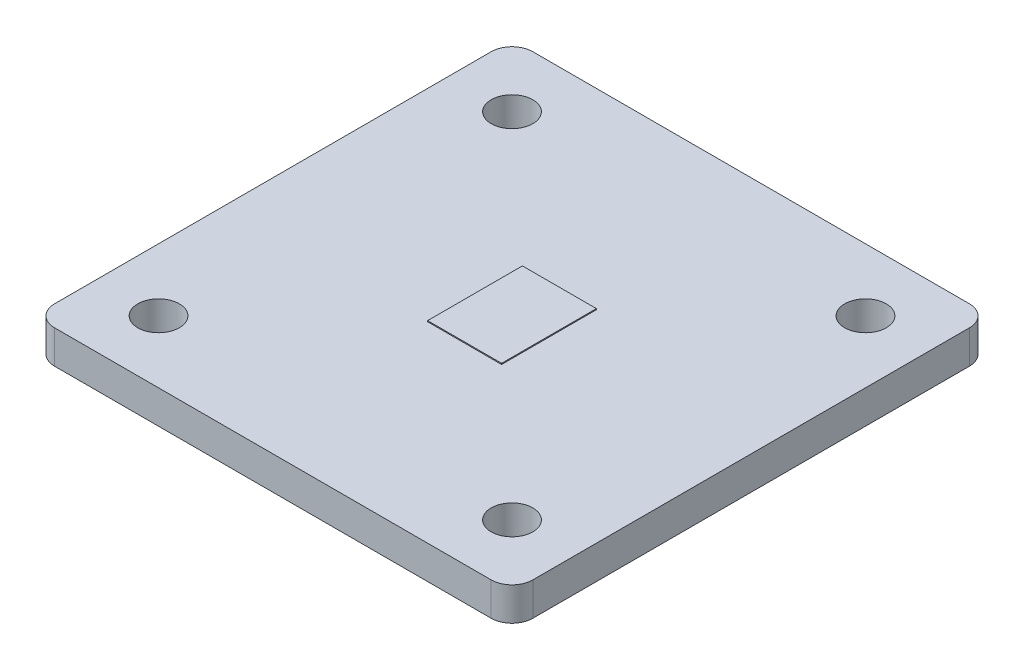
from build123d import *

# Parameters (mm, degrees)
BOSS_EXTRUDE1_DEPTH = 1.6
SKETCH2_R           = 1
CUT_EXTRUDE1_DEPTH  = 1.6
SKETCH4_W           = 3.557
SKETCH4_H           = 4.557
BOSS_EXTRUDE2_DEPTH = 0.05


with BuildPart() as part:
    # Sketch1 → Boss-Extrude1 (new body)
    with BuildSketch(Plane(origin=(0, 0, 0), x_dir=(1, 0, 0), z_dir=(0, 1, 0))):
        with BuildLine():
            Line((-10.5, -11.5), (10.5, -11.5))
            ThreePointArc((10.5, -11.5), (11.207106781, -11.207106781), (11.5, -10.5))
            Line((11.5, -10.5), (11.5, 10.5))
            ThreePointArc((11.5, 10.5), (11.207106781, 11.207106781), (10.5, 11.5))
            Line((10.5, 11.5), (-10.5, 11.5))
            ThreePointArc((-10.5, 11.5), (-11.207106781, 11.207106781), (-11.5, 10.5))
            Line((-11.5, 10.5), (-11.5, -10.5))
            ThreePointArc((-11.5, -10.5), (-11.207106781, -11.207106781), (-10.5, -11.5))
        make_face()
    extrude(amount=BOSS_EXTRUDE1_DEPTH)

    # Sketch2 → Cut-Extrude1 (cut)
    with BuildSketch(Plane(origin=(0, 1.6, 0), x_dir=(1, 0, 0), z_dir=(0, 1, 0))):
        with Locations(Location((-8.5, 8.5, 0), (0, 0, 270))):
            Circle(SKETCH2_R)
        with Locations(Location((-8.5, -8.5, 0), (0, 0, 90))):
            Circle(SKETCH2_R)
        with Locations(Location((8.5, 8.5, 0), (0, 0, 90))):
            Circle(SKETCH2_R)
        with Locations(Location((8.5, -8.5, 0), (0, 0, 270))):
            Circle(SKETCH2_R)
    extrude(amount=-CUT_EXTRUDE1_DEPTH, mode=Mode.SUBTRACT)

    # Sketch4 → Boss-Extrude2 (add)
    with BuildSketch(Plane(origin=(0, 1.6, 0), x_dir=(1, 0, 0), z_dir=(0, 1, 0))):
        Rectangle(SKETCH4_W, SKETCH4_H)
    extrude(amount=BOSS_EXTRUDE2_DEPTH)


solid = part.part
